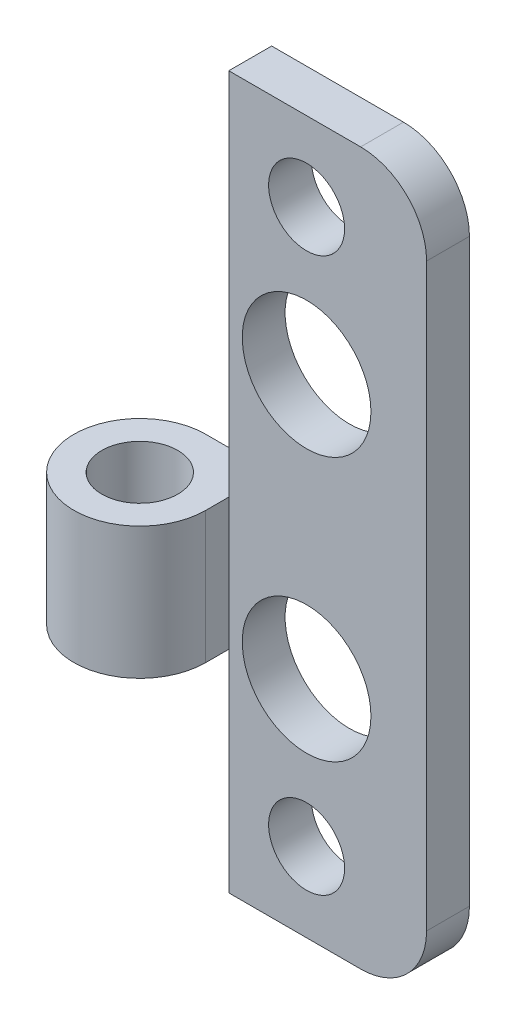
from build123d import *

# Parameters (mm, degrees)
SKETCH1_R           = 3.6576
BOSS_EXTRUDE1_DEPTH = 4.1275
BOSS_EXTRUDE2_START = -35.56
SKETCH2_R           = 3.6576
BOSS_EXTRUDE2_DEPTH = 12.7
SKETCH3_R           = 6.1976
CUT_EXTRUDE1_DEPTH  = 72.691050043


with BuildPart() as part:
    # Sketch1 → Boss-Extrude1 (new body)
    with BuildSketch(Plane.XY):
        with BuildLine():
            Line((0, 0), (12.7, 0))
            ThreePointArc((12.7, 0), (17.190128061, 1.859871939), (19.05, 6.35))
            Line((19.05, 6.35), (19.05, 62.23))
            ThreePointArc((19.05, 62.23), (17.190128061, 66.720128061), (12.7, 68.58))
            Line((12.7, 68.58), (0, 68.58))
            Line((0, 68.58), (0, 0))
        make_face()
        with Locations((7.493, 60.96)):
            Circle(SKETCH1_R, mode=Mode.SUBTRACT)
        with Locations((7.493, 7.62)):
            Circle(SKETCH1_R, mode=Mode.SUBTRACT)
    extrude(amount=BOSS_EXTRUDE1_DEPTH)

    # Sketch2 → Boss-Extrude2 (add)
    with BuildSketch(Plane(origin=(0, 68.58, 0), x_dir=(1, 0, 0), z_dir=(0, 1, 0)).offset(BOSS_EXTRUDE2_START)):
        with BuildLine():
            Line((0, 0), (-6.35, 0))
            ThreePointArc((-6.35, 0), (-10.840128061, -10.840128061), (0, -6.35))
            Line((0, -6.35), (0, -4.1275))
            Line((0, -4.1275), (0, 0))
        make_face()
        with Locations(Location((-6.35, -6.35, 0), (0, 0, 270))):
            Circle(SKETCH2_R, mode=Mode.SUBTRACT)
    extrude(amount=-BOSS_EXTRUDE2_DEPTH)

    # Sketch3 → Cut-Extrude1 (cut, through all)
    with BuildSketch(Plane.XY.offset(4.1275)):
        with Locations((7.493, 46.99)):
            Circle(SKETCH3_R)
        with Locations((7.493, 21.59)):
            Circle(SKETCH3_R)
    extrude(amount=-CUT_EXTRUDE1_DEPTH, mode=Mode.SUBTRACT)


solid = part.part
